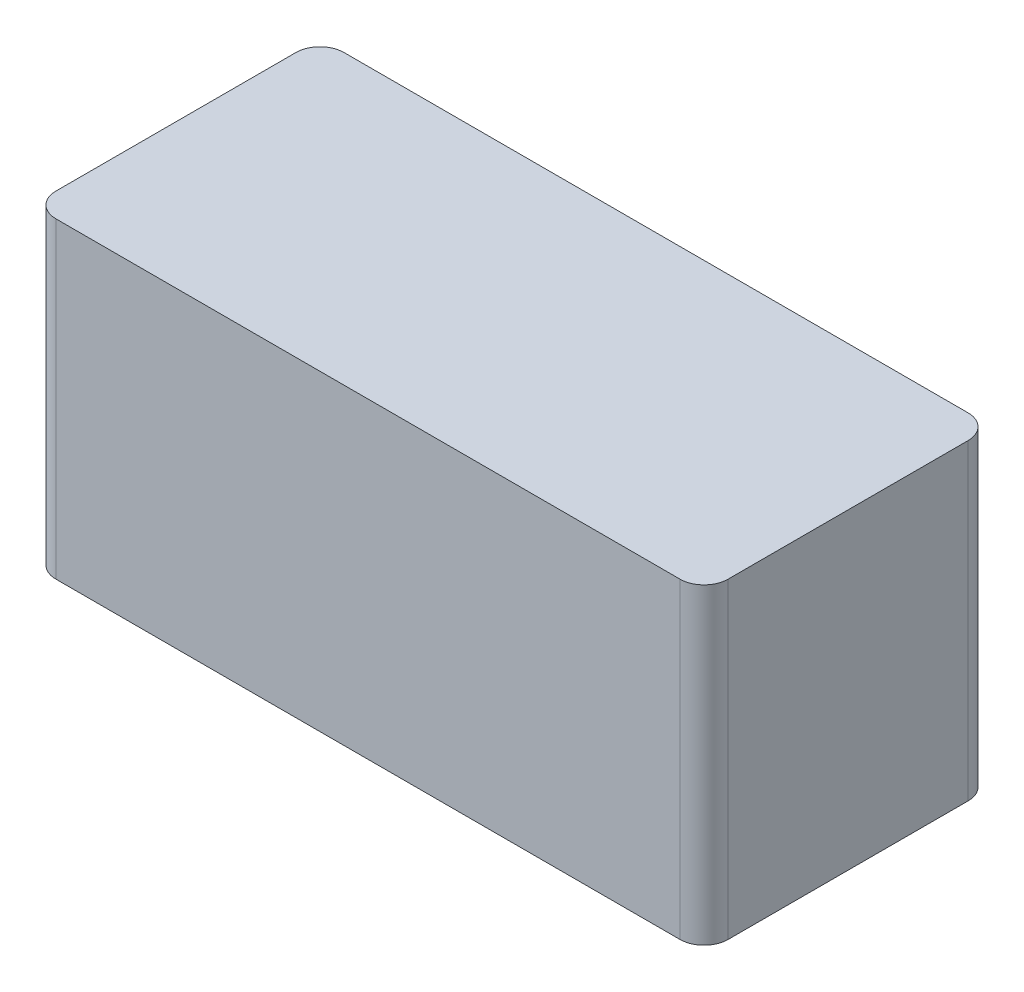
from build123d import *

# Parameters (mm, degrees)
SKETCH1_W           = 140
SKETCH1_H           = 60
BOSS_EXTRUDE1_DEPTH = 65
FILLET1_R           = 5


with BuildPart() as part:
    # Sketch1 → Boss-Extrude1 (new body)
    with BuildSketch(Plane(origin=(0, 0, 0), x_dir=(1, 0, 0), z_dir=(0, 1, 0))):
        Rectangle(SKETCH1_W, SKETCH1_H)
    extrude(amount=BOSS_EXTRUDE1_DEPTH)

    # Fillet1
    fillet1_edges = [part.edges().sort_by_distance(p)[0] for p in [
        (70, 32.5, 30),
        (-70, 32.5, 30),
        (-70, 32.5, -30),
        (70, 32.5, -30),
    ]]
    fillet(fillet1_edges, radius=FILLET1_R)


solid = part.part
